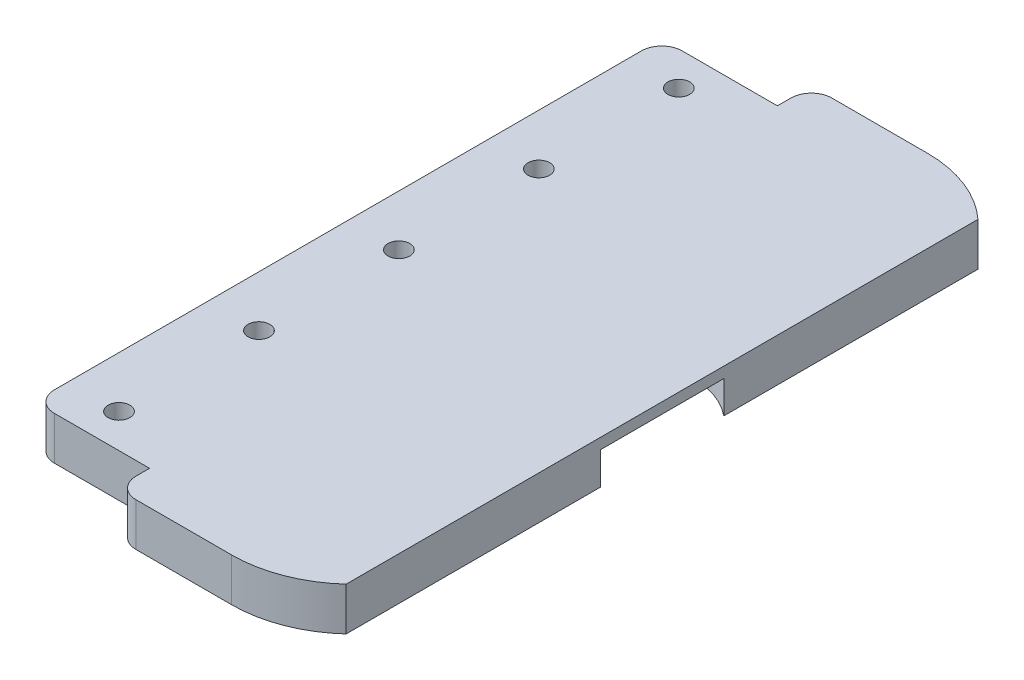
from build123d import *

# Parameters (mm, degrees)
SKETCH1_W           = 52.084
SKETCH1_H           = 102.362
BOSS_EXTRUDE1_DEPTH = 6.35
SKETCH1_4_R         = 1.6
CUT_EXTRUDE2_DEPTH  = 116.026277867
SKETCH1_5_R         = 3.556
CUT_EXTRUDE3_DEPTH  = 4.7625
FILLET1_R           = 18
SKETCH1_7_W         = 17
SKETCH1_7_H         = 5
CUT_EXTRUDE4_DEPTH  = 116.026277867
FILLET4_R           = 3
SKETCH3_W           = 22.451753575
SKETCH3_H           = 92.950303638
CUT_EXTRUDE6_DEPTH  = 6.35


with BuildPart() as part:
    # Sketch1 → Boss-Extrude1 (new body)
    with BuildSketch(Plane(origin=(0, 0, 0), x_dir=(1, 0, 0), z_dir=(0, 1, 0))):
        with Locations((26.042, 51.181)):
            Rectangle(SKETCH1_W, SKETCH1_H)
    extrude(amount=BOSS_EXTRUDE1_DEPTH)

    # Sketch1<4> → Cut-Extrude2 (cut, through all)
    with BuildSketch(Plane(origin=(0, 0, 0), x_dir=(1, 0, 0), z_dir=(0, 1, 0))):
        with BuildLine():
            ThreePointArc((9.1, 71.772), (8.63137085, 72.90337085), (7.5, 73.372))
            Line((7.5, 73.372), (7.5, 70.172))
            ThreePointArc((7.5, 70.172), (8.63137085, 70.64062915), (9.1, 71.772))
        make_face()
        with BuildLine():
            Line((7.5, 70.172), (7.5, 73.372))
            ThreePointArc((7.5, 73.372), (5.9, 71.772), (7.5, 70.172))
        make_face()
        with Locations(Location((7.5, 92.362, 0), (0, 0, 270))):
            Circle(SKETCH1_4_R)
        with Locations(Location((7.5, 51.182, 0), (0, 0, 270))):
            Circle(SKETCH1_4_R)
        with Locations(Location((7.5, 30.592, 0), (0, 0, 270))):
            Circle(SKETCH1_4_R)
        with Locations(Location((7.5, 10.002, 0), (0, 0, 270))):
            Circle(SKETCH1_4_R)
    extrude(amount=CUT_EXTRUDE2_DEPTH, mode=Mode.SUBTRACT)

    # Sketch1<5> → Cut-Extrude3 (cut)
    with BuildSketch(Plane(origin=(0, 0, 0), x_dir=(1, 0, 0), z_dir=(0, 1, 0))):
        with Locations(Location((38.876, 95.63, 0), (0, 0, 90))):
            Circle(SKETCH1_5_R)
        with Locations(Location((38.876, 6.73, 0), (0, 0, 90))):
            Circle(SKETCH1_5_R)
        with BuildLine():
            Line((30.360375772, 43.18), (30.360375772, 59.18))
            ThreePointArc((30.360375772, 59.18), (50.56, 51.18), (30.360375772, 43.18))
        make_face()
    extrude(amount=CUT_EXTRUDE3_DEPTH, mode=Mode.SUBTRACT)

    # Fillet1
    fillet1_edges = [part.edges().sort_by_distance(p)[0] for p in [
        (52.084, 3.175, 0),
        (52.084, 3.175, -102.362),
    ]]
    fillet(fillet1_edges, radius=FILLET1_R)

    # Sketch1<7> → Cut-Extrude4 (cut, through all)
    with BuildSketch(Plane(origin=(0, 0, 0), x_dir=(1, 0, 0), z_dir=(0, 1, 0))):
        with Locations((8.5, 2.5)):
            Rectangle(SKETCH1_7_W, SKETCH1_7_H)
        with Locations((8.5, 99.862)):
            Rectangle(SKETCH1_7_W, SKETCH1_7_H)
    extrude(amount=CUT_EXTRUDE4_DEPTH, mode=Mode.SUBTRACT)

    # Fillet4
    fillet4_edges = [part.edges().sort_by_distance(p)[0] for p in [
        (0, 3.175, -5),
        (17, 3.175, 0),
        (0, 3.175, -97.362),
        (17, 3.175, -102.362),
    ]]
    fillet(fillet4_edges, radius=FILLET4_R)

    # Sketch3 → Cut-Extrude6 (cut)
    with BuildSketch(Plane.XZ):
        with Locations((57.445177666, -51.181)):
            Rectangle(SKETCH3_W, SKETCH3_H)
    extrude(amount=-CUT_EXTRUDE6_DEPTH, mode=Mode.SUBTRACT)


solid = part.part
